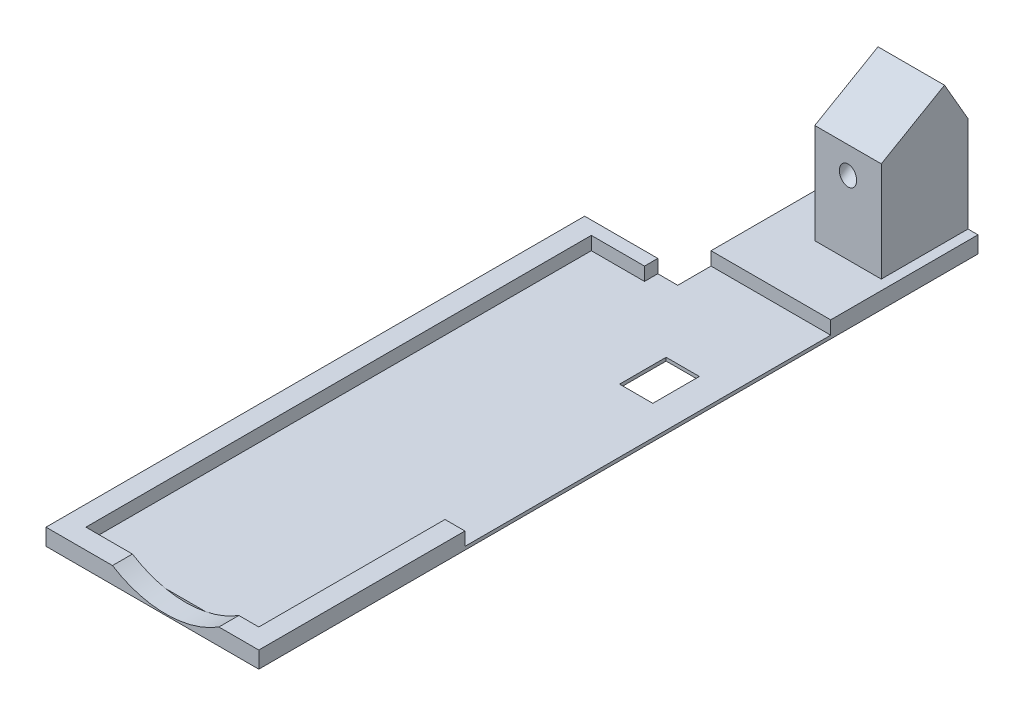
from build123d import *

# Parameters (mm, degrees)
BOSS_EXTRUDE1_DEPTH = 10
SKETCH2_R           = 1.75
CUT_EXTRUDE1_DEPTH  = 35
DRAFT1_ANGLE        = 2
BOSS_EXTRUDE2_DEPTH = 2.5
SKETCH6_W           = 26
SKETCH6_H           = 76
CUT_EXTRUDE4_DEPTH  = 2
SKETCH7_W           = 5
SKETCH7_H           = 7
CUT_EXTRUDE5_DEPTH  = 1
CUT_EXTRUDE6_DEPTH  = 5
SKETCH9_W           = 21
SKETCH9_H           = 55
CUT_EXTRUDE7_DEPTH  = 2


with BuildPart() as part:
    # Sketch1 → Boss-Extrude1 (new body)
    with BuildSketch(Plane(origin=(0, 0, 0), x_dir=(0, 0, -1), z_dir=(1, 0, 0))):
        Polygon((19.10611554, 15.010195009), (28.614736708, 20.5), (32.149736708, 14.377200395), (32.149736708, 0), (19.10611554, 0), align=None)
    extrude(amount=BOSS_EXTRUDE1_DEPTH)

    # Sketch2 → Cut-Extrude1 (cut)
    with BuildSketch(Plane(origin=(0, 17.515544456, -30.33781292), x_dir=(1, 0, 0), z_dir=(0, 0.5000000000000014, -0.8660254037844378))):
        with Locations(Location((5, 0.053847576, 0), (0, 0, 270))):
            Circle(SKETCH2_R)
    extrude(amount=-CUT_EXTRUDE1_DEPTH, mode=Mode.SUBTRACT)

    # Draft1
    draft1_faces = [part.faces().sort_by_distance(p)[0] for p in [
        (5, 12.426932649, -25.131773882),
    ]]
    draft(draft1_faces, Plane(origin=(10, 20.5, -28.614736708), x_dir=(0, -0.8660254037844377, -0.5000000000000018), z_dir=(0, 0.5000000000000017, -0.8660254037844376)), DRAFT1_ANGLE)

    # Sketch5 → Boss-Extrude2 (add)
    with BuildSketch(Plane.XZ):
        Polygon((11.5, 76), (-20.5, 76), (-20.5, -5), (-6.5, -5), (-6.5, -32.15), (11.5, -32.15), align=None)
    extrude(amount=BOSS_EXTRUDE2_DEPTH)

    # Sketch6 → Cut-Extrude4 (cut)
    with BuildSketch(Plane(origin=(0, 0, 0), x_dir=(1, 0, 0), z_dir=(0, 1, 0))):
        with Locations((-4.5, -35)):
            Rectangle(SKETCH6_W, SKETCH6_H)
    extrude(amount=-CUT_EXTRUDE4_DEPTH, mode=Mode.SUBTRACT)

    # Sketch7 → Cut-Extrude5 (cut)
    with BuildSketch(Plane(origin=(0, -2, 0), x_dir=(1, 0, 0), z_dir=(0, 1, 0))):
        with Locations((4.5, -8.75)):
            Rectangle(SKETCH7_W, SKETCH7_H)
    extrude(amount=-CUT_EXTRUDE5_DEPTH, mode=Mode.SUBTRACT)

    # Sketch8 → Cut-Extrude6 (cut)
    with BuildSketch(Plane(origin=(0, 0, 73), x_dir=(-1, 0, 0), z_dir=(0, 0, -1))):
        with BuildLine():
            Line((-5.5, 0), (10.5, 0))
            ThreePointArc((10.5, 0), (2.5, -2.31142246), (-5.5, 0))
        make_face()
    extrude(amount=-CUT_EXTRUDE6_DEPTH, mode=Mode.SUBTRACT)

    # Sketch9 → Cut-Extrude7 (cut)
    with BuildSketch(Plane(origin=(0, 0, 0), x_dir=(1, 0, 0), z_dir=(0, 1, 0))):
        with Locations((1, -17.5)):
            Rectangle(SKETCH9_W, SKETCH9_H)
    extrude(amount=-CUT_EXTRUDE7_DEPTH, mode=Mode.SUBTRACT)


solid = part.part
